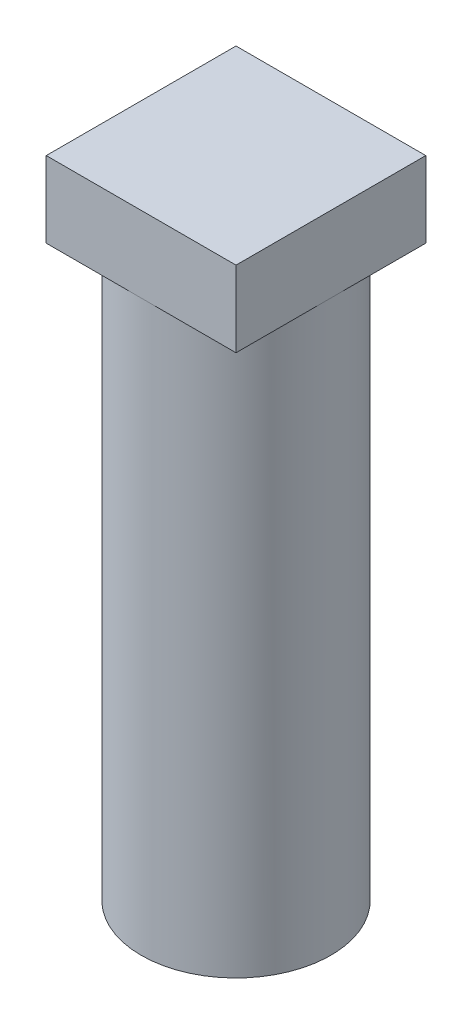
from build123d import *

# Parameters (mm, degrees)
SKETCH1_R           = 2.5
BOSS_EXTRUDE1_DEPTH = 15
SKETCH2_W           = 5
SKETCH2_H           = 5
BOSS_EXTRUDE2_DEPTH = 2


with BuildPart() as part:
    # Sketch1 → Boss-Extrude1 (new body)
    with BuildSketch(Plane(origin=(0, 0, 0), x_dir=(1, 0, 0), z_dir=(0, 1, 0))):
        with Locations(Location((0, 0, 0), (0, 0, 270))):
            Circle(SKETCH1_R)
    extrude(amount=BOSS_EXTRUDE1_DEPTH)

    # Sketch2 → Boss-Extrude2 (add)
    with BuildSketch(Plane(origin=(0, 15, 0), x_dir=(1, 0, 0), z_dir=(0, 1, 0))):
        Rectangle(SKETCH2_W, SKETCH2_H)
    extrude(amount=BOSS_EXTRUDE2_DEPTH)


solid = part.part
